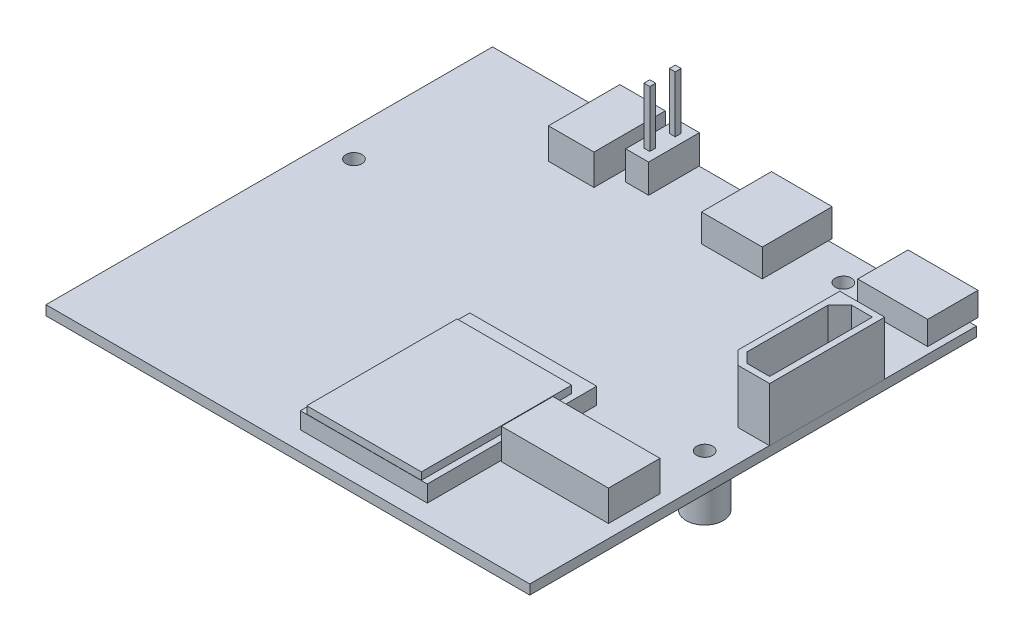
from build123d import *

# Parameters (mm, degrees)
SKETCH1_W                  = 52
SKETCH1_H                  = 48
BASE_DEPTH                 = 1.04
SKETCH8_W                  = 4.8895
SKETCH8_H                  = 7.6708
DC_POWER_DEPTH             = 3.302
SKETCH9_R                  = 1.25
DC_POWER_HOLE_DEPTH        = 5.842
SKETCH10_R                 = 0.4
DC_POWER_PIN_DEPTH         = 4.1656
SKETCH11_W                 = 2.4638
SKETCH11_H                 = 5.461
PWM_PIN_BASE_DEPTH         = 3.0988
SKETCH12_W                 = 0.635
SKETCH12_H                 = 0.635
PWM_PINS_DEPTH             = 6.0452
SKETCH13_W                 = 6.5278
SKETCH13_H                 = 7.5184
MICRO_HDMI_PORT_DEPTH      = 2.9718
SKETCH14_W                 = 7.5184
SKETCH14_H                 = 5.4102
MICRO_USB_PORT_DEPTH       = 2.54
HEADER_HOLE_REACH          = 74.096
SKETCH15_R                 = 0.8636
SKETCH16_R                 = 1.9939
STANDOFFS_1_DEPTH          = 4.4704
SKETCH17_R                 = 1.9939
SHORT_STANDOFF_DEPTH       = 4.4704
THREADS_IN_STANDOFFS_REACH = 74.096
SKETCH19_R                 = 0.8636
SKETCH20_W                 = 12.1158
SKETCH20_H                 = 12.1158
CPU_DEPTH                  = 1.4732
UART_PLASTIC_DEPTH         = 5.7912
UART_HOLE_DEPTH            = 4.1656
SKETCH23_W                 = 11.5062
SKETCH23_H                 = 5.5372
MICROSD_DEPTH              = 3.302
SKETCH24_W                 = 13.6398
SKETCH24_H                 = 18.2118
EMMC_BOARD_DEPTH           = 1.778
SKETCH25_W                 = 12.319
SKETCH25_H                 = 16.1544
EMMC_CHIP_DEPTH            = 0.7874


with BuildPart() as part:
    # Sketch1 → Base (new body)
    with BuildSketch(Plane(origin=(0, 0, 0), x_dir=(1, 0, 0), z_dir=(0, 1, 0))):
        with Locations((26, 24)):
            Rectangle(SKETCH1_W, SKETCH1_H)
    extrude(amount=BASE_DEPTH)

    # Sketch8 → DC power (add)
    with BuildSketch(Plane(origin=(0, 1.04, 0), x_dir=(1, 0, 0), z_dir=(0, 1, 0))):
        with Locations((16.09725, 44.19)):
            Rectangle(SKETCH8_W, SKETCH8_H)
    extrude(amount=DC_POWER_DEPTH)

    # Sketch9 → DC power hole (cut)
    with BuildSketch(Plane(origin=(0, 0, -48.0254), x_dir=(-1, 0, 0), z_dir=(0, 0, -1))):
        with Locations((-16.09725, 2.3154)):
            Circle(SKETCH9_R)
    extrude(amount=-DC_POWER_HOLE_DEPTH, mode=Mode.SUBTRACT)

    # Sketch10 → DC power pin (add)
    with BuildSketch(Plane(origin=(0, 0, -42.1834), x_dir=(-1, 0, 0), z_dir=(0, 0, -1))):
        with Locations((-16.09725, 2.3154)):
            Circle(SKETCH10_R)
    extrude(amount=DC_POWER_PIN_DEPTH)

    # Sketch11 → PWM pin base (add)
    with BuildSketch(Plane(origin=(0, 1.04, 0), x_dir=(1, 0, 0), z_dir=(0, 1, 0))):
        with Locations((20.9739, 45.2949)):
            Rectangle(SKETCH11_W, SKETCH11_H)
    extrude(amount=PWM_PIN_BASE_DEPTH)

    # Sketch12 → PWM pins (add)
    with BuildSketch(Plane(origin=(0, 4.1388, 0), x_dir=(1, 0, 0), z_dir=(0, 1, 0))):
        with Locations((20.9739, 43.92965)):
            Rectangle(SKETCH12_W, SKETCH12_H)
        with Locations((20.9739, 46.66015)):
            Rectangle(SKETCH12_W, SKETCH12_H)
    extrude(amount=PWM_PINS_DEPTH)

    # Sketch13 → Micro HDMI port (add)
    with BuildSketch(Plane(origin=(0, 1.04, 0), x_dir=(1, 0, 0), z_dir=(0, 1, 0))):
        with Locations((32.8357, 44.6472)):
            Rectangle(SKETCH13_W, SKETCH13_H)
    extrude(amount=MICRO_HDMI_PORT_DEPTH)

    # Sketch14 → Micro USB port (add)
    with BuildSketch(Plane(origin=(0, 1.04, 0), x_dir=(1, 0, 0), z_dir=(0, 1, 0))):
        with Locations((47.5296, 46.1839)):
            Rectangle(SKETCH14_W, SKETCH14_H)
    extrude(amount=MICRO_USB_PORT_DEPTH)

    # Sketch15 → Header hole (cut, up to next)
    with BuildSketch(Plane(origin=(0, 0, 0), x_dir=(-1, 0, 0), z_dir=(0, -1, 0)), mode=Mode.PRIVATE) as header_hole_sk1:
        with Locations(Location((-3, 30.1, 0), (0, 0, 90))):
            Circle(SKETCH15_R)
    header_hole_tool1 = extrude(header_hole_sk1.sketch, amount=-HEADER_HOLE_REACH, mode=Mode.PRIVATE) & part.part
    # Sketch15 → Header hole (cut, up to next)
    with BuildSketch(Plane(origin=(0, 0, 0), x_dir=(-1, 0, 0), z_dir=(0, -1, 0)), mode=Mode.PRIVATE) as header_hole_sk2:
        with Locations(Location((-49, 21.8012, 0), (0, 0, 90))):
            Circle(SKETCH15_R)
    header_hole_tool2 = extrude(header_hole_sk2.sketch, amount=-HEADER_HOLE_REACH, mode=Mode.PRIVATE) & part.part
    # Sketch15 → Header hole (cut, up to next)
    with BuildSketch(Plane(origin=(0, 0, 0), x_dir=(-1, 0, 0), z_dir=(0, -1, 0)), mode=Mode.PRIVATE) as header_hole_sk3:
        with Locations(Location((-40.8, 44.9012, 0), (0, 0, 90))):
            Circle(SKETCH15_R)
    header_hole_tool3 = extrude(header_hole_sk3.sketch, amount=-HEADER_HOLE_REACH, mode=Mode.PRIVATE) & part.part
    add(header_hole_tool1.solids().sort_by_distance((3, 0, -30.1))[0], mode=Mode.SUBTRACT)
    add(header_hole_tool2.solids().sort_by_distance((49, 0, -21.8012))[0], mode=Mode.SUBTRACT)
    add(header_hole_tool3.solids().sort_by_distance((40.8, 0, -44.9012))[0], mode=Mode.SUBTRACT)

    # Sketch16 → Standoffs 1 (add)
    with BuildSketch(Plane.XZ):
        with Locations(Location((49, -21.8012, 0), (0, 0, 270))):
            Circle(SKETCH16_R)
        with Locations(Location((3, -30.1, 0), (0, 0, 270))):
            Circle(SKETCH16_R)
    extrude(amount=STANDOFFS_1_DEPTH)

    # Sketch17 → Short standoff (add)
    with BuildSketch(Plane.XZ):
        with Locations(Location((40.8, -44.9012, 0), (0, 0, 270))):
            Circle(SKETCH17_R)
    extrude(amount=SHORT_STANDOFF_DEPTH)

    # Sketch19 → Threads in standoffs (cut, up to next)
    with BuildSketch(Plane.XZ, mode=Mode.PRIVATE) as threads_in_standoffs_sk1:
        with Locations(Location((40.8, -44.9012, 0), (0, 0, 270))):
            Circle(SKETCH19_R)
    threads_in_standoffs_tool1 = extrude(threads_in_standoffs_sk1.sketch, amount=THREADS_IN_STANDOFFS_REACH, mode=Mode.PRIVATE) & part.part
    # Sketch19 → Threads in standoffs (cut, up to next)
    with BuildSketch(Plane.XZ, mode=Mode.PRIVATE) as threads_in_standoffs_sk2:
        with Locations(Location((49, -21.8012, 0), (0, 0, 270))):
            Circle(SKETCH19_R)
    threads_in_standoffs_tool2 = extrude(threads_in_standoffs_sk2.sketch, amount=THREADS_IN_STANDOFFS_REACH, mode=Mode.PRIVATE) & part.part
    # Sketch19 → Threads in standoffs (cut, up to next)
    with BuildSketch(Plane.XZ, mode=Mode.PRIVATE) as threads_in_standoffs_sk3:
        with Locations(Location((3, -30.1, 0), (0, 0, 270))):
            Circle(SKETCH19_R)
    threads_in_standoffs_tool3 = extrude(threads_in_standoffs_sk3.sketch, amount=THREADS_IN_STANDOFFS_REACH, mode=Mode.PRIVATE) & part.part
    add(threads_in_standoffs_tool1.solids().sort_by_distance((40.8, 0, -44.9012))[0], mode=Mode.SUBTRACT)
    add(threads_in_standoffs_tool2.solids().sort_by_distance((49, 0, -21.8012))[0], mode=Mode.SUBTRACT)
    add(threads_in_standoffs_tool3.solids().sort_by_distance((3, 0, -30.1))[0], mode=Mode.SUBTRACT)

    # Sketch20 → CPU (add)
    with BuildSketch(Plane(origin=(0, 0, 0), x_dir=(-1, 0, 0), z_dir=(0, -1, 0))):
        with Locations((-37.8141, 31.1979)):
            Rectangle(SKETCH20_W, SKETCH20_H)
    extrude(amount=CPU_DEPTH)

    # Sketch21 → UART plastic (add)
    with BuildSketch(Plane(origin=(0, 1.04, 0), x_dir=(1, 0, 0), z_dir=(0, 1, 0))):
        Polygon((52.0254, 38.1254), (47.1994, 38.1254), (47.1994, 27.192440979), (48.636240979, 25.7556), (52.0254, 25.7556), align=None)
    extrude(amount=UART_PLASTIC_DEPTH)

    # Sketch22 → UART hole (cut)
    with BuildSketch(Plane(origin=(0, 6.8312, 0), x_dir=(1, 0, 0), z_dir=(0, 1, 0))):
        Polygon((51.365, 37.465), (49.134996369, 37.465), (47.8598, 36.189803631), (47.8598, 27.465987616), (48.909787616, 26.416), (51.365, 26.416), align=None)
    extrude(amount=-UART_HOLE_DEPTH, mode=Mode.SUBTRACT)

    # Sketch23 → MicroSD (add)
    with BuildSketch(Plane(origin=(0, 1.04, 0), x_dir=(1, 0, 0), z_dir=(0, 1, 0))):
        with Locations((44.8499, 12.6238)):
            Rectangle(SKETCH23_W, SKETCH23_H)
    extrude(amount=MICROSD_DEPTH)

    # Sketch24 → eMMC board (add)
    with BuildSketch(Plane(origin=(0, 1.04, 0), x_dir=(1, 0, 0), z_dir=(0, 1, 0))):
        with Locations((32.1437, 11.1252)):
            Rectangle(SKETCH24_W, SKETCH24_H)
    extrude(amount=EMMC_BOARD_DEPTH)

    # Sketch25 → eMMC chip (add)
    with BuildSketch(Plane(origin=(0, 2.818, 0), x_dir=(1, 0, 0), z_dir=(0, 1, 0))):
        with Locations((32.1437, 10.1219)):
            Rectangle(SKETCH25_W, SKETCH25_H)
    extrude(amount=EMMC_CHIP_DEPTH)


solid = part.part
